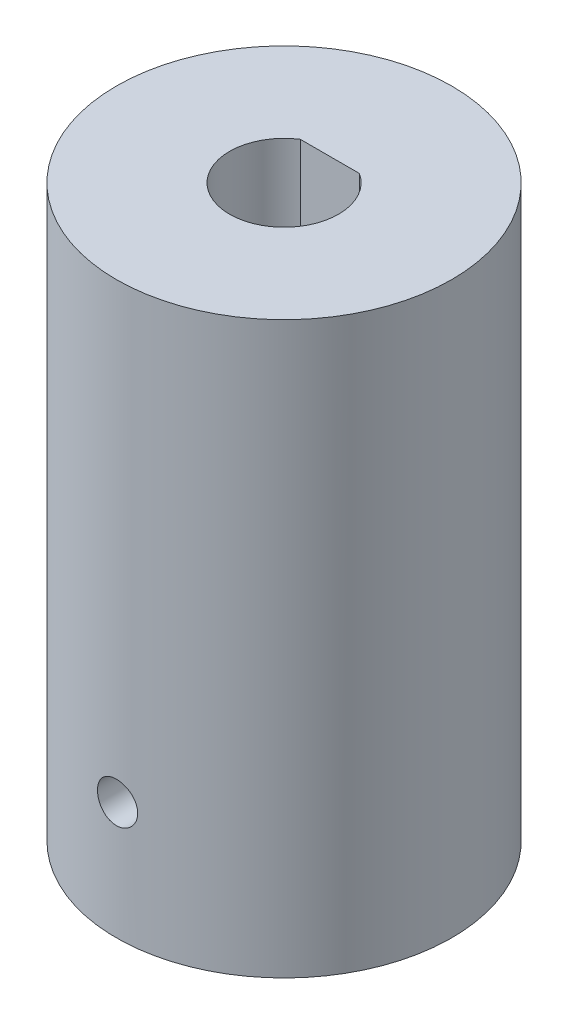
from build123d import *

# Parameters (mm, degrees)
SKETCH1_R               = 12.7
BOSS_EXTRUDE1_DEPTH     = 50.8
SKETCH4_R               = 6.35
CUT_EXTRUDE2_DEPTH      = 33.02
CUT_EXTRUDE3_DEPTH      = 54.881536726
CUT_EXTRUDE3_DEPTH_BACK = 54.881536726
SKETCH5_R               = 1.524
CUT_EXTRUDE4_DEPTH      = 15.24
SKETCH7_R               = 1.9939
CUT_EXTRUDE5_DEPTH      = 15.24
SKETCH8_R               = 14.2875
CUT_EXTRUDE6_DEPTH      = 7.62


with BuildPart() as part:
    # Sketch1 → Boss-Extrude1 (new body)
    with BuildSketch(Plane(origin=(0, 0, 0), x_dir=(1, 0, 0), z_dir=(0, 1, 0))):
        with Locations(Location((0, 0, 0), (0, 0, 270))):
            Circle(SKETCH1_R)
    extrude(amount=BOSS_EXTRUDE1_DEPTH)

    # Sketch4 → Cut-Extrude2 (cut)
    with BuildSketch(Plane.XZ):
        with Locations(Location((0, 0, 0), (0, 0, 270))):
            Circle(SKETCH4_R)
    extrude(amount=-CUT_EXTRUDE2_DEPTH, mode=Mode.SUBTRACT)

    # Sketch5 → Cut-Extrude3 (cut, two sides: drawn at the far end of the back side and taken through both)
    with BuildSketch(Plane.XY.offset(-CUT_EXTRUDE3_DEPTH_BACK)):
        with Locations((0, 16.51)):
            Circle(SKETCH5_R)
    extrude(amount=CUT_EXTRUDE3_DEPTH + CUT_EXTRUDE3_DEPTH_BACK, mode=Mode.SUBTRACT)

    # Sketch6 → Cut-Extrude4 (cut)
    with BuildSketch(Plane(origin=(0, 50.8, 0), x_dir=(1, 0, 0), z_dir=(0, 1, 0))):
        with BuildLine():
            Line((-2.238756, 3.467596837), (2.238756, 3.467596837))
            ThreePointArc((2.238756, 3.467596837), (0, -4.1275), (-2.238756, 3.467596837))
        make_face()
    extrude(amount=-CUT_EXTRUDE4_DEPTH, mode=Mode.SUBTRACT)

    # Sketch7 → Cut-Extrude5 (cut)
    with BuildSketch(Plane.XY):
        with Locations(Location((0, 43.18, 0), (0, 0, 90))):
            Circle(SKETCH7_R)
    extrude(amount=-CUT_EXTRUDE5_DEPTH, mode=Mode.SUBTRACT)

    # Sketch8 → Cut-Extrude6 (cut)
    with BuildSketch(Plane.XZ):
        Circle(SKETCH8_R)
    extrude(amount=-CUT_EXTRUDE6_DEPTH, mode=Mode.SUBTRACT)


solid = part.part
